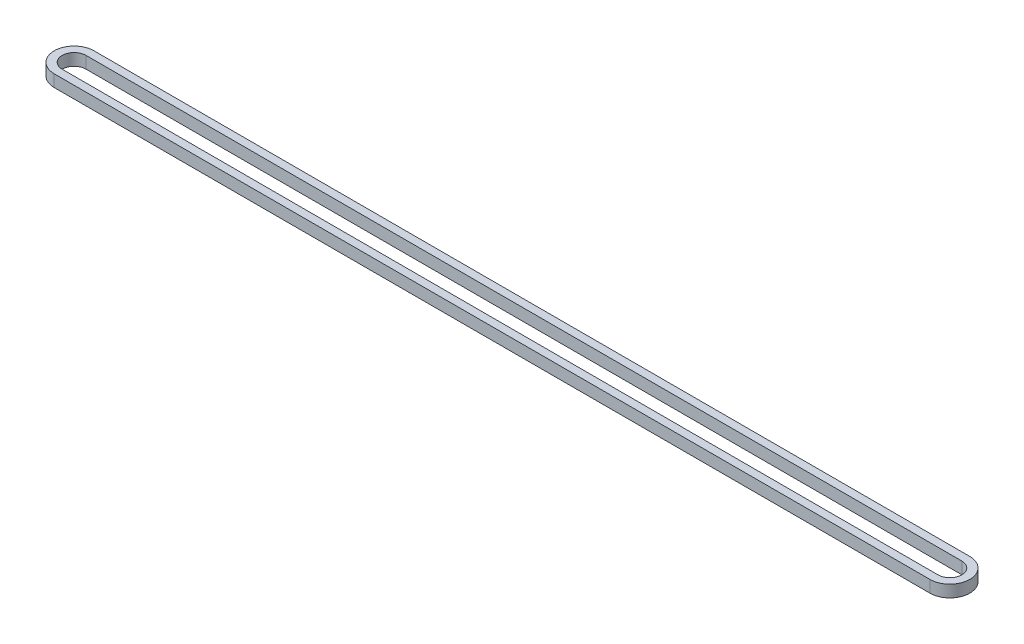
from build123d import *

# Parameters (mm, degrees)
EXTRUDE_1_DEPTH = 3


with BuildPart() as part:
    # 草图1 → 拉伸-薄壁1 (new body)
    with BuildSketch(Plane(origin=(0, 0, 0), x_dir=(1, 0, 0), z_dir=(0, 1, 0))):
        with BuildLine():
            Line((220, -5), (0, -5))
            ThreePointArc((0, -5), (-5, 0), (0, 5))
            Line((0, 5), (220, 5))
            ThreePointArc((220, 5), (225, 0), (220, -5))
        make_face()
        with BuildLine():
            Line((220, -3), (0, -3))
            ThreePointArc((0, -3), (-3, 0), (0, 3))
            Line((0, 3), (220, 3))
            ThreePointArc((220, 3), (223, 0), (220, -3))
        make_face(mode=Mode.SUBTRACT)
    extrude(amount=EXTRUDE_1_DEPTH)


solid = part.part
